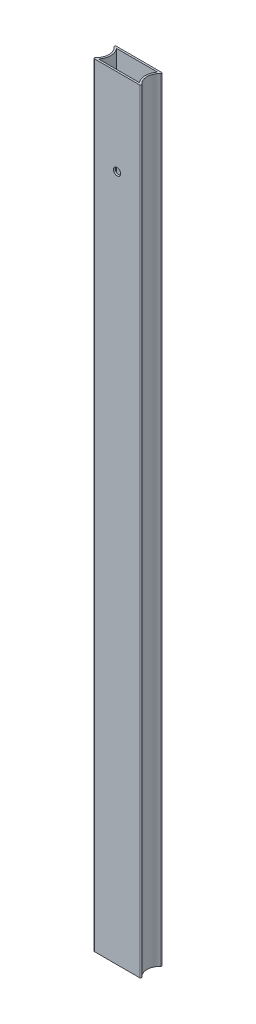
from build123d import *

# Parameters (mm, degrees)
BOSS_EXTRUDE1_DEPTH = 850
SHELL1_T            = -2
SKETCH2_R           = 4
CUT_EXTRUDE1_DEPTH  = 851.730122418


with BuildPart() as part:
    # Sketch1 → Boss-Extrude1 (new body)
    with BuildSketch(Plane(origin=(0, 0, 0), x_dir=(1, 0, 0), z_dir=(0, 1, 0))):
        with BuildLine():
            Line((-24.801960973, -12), (24.801960973, -12))
            ThreePointArc((24.801960973, -12), (25.732910309, -11.365148372), (25.481830241, -10.266666667))
            ThreePointArc((25.481830241, -10.266666667), (21, 0), (25.481830241, 10.266666667))
            ThreePointArc((25.481830241, 10.266666667), (25.732910309, 11.365148372), (24.801960973, 12))
            Line((24.801960973, 12), (-24.801960973, 12))
            ThreePointArc((-24.801960973, 12), (-25.732910309, 11.365148372), (-25.481830241, 10.266666667))
            ThreePointArc((-25.481830241, 10.266666667), (-21, 0), (-25.481830241, -10.266666667))
            ThreePointArc((-25.481830241, -10.266666667), (-25.732910309, -11.365148372), (-24.801960973, -12))
        make_face()
    extrude(amount=BOSS_EXTRUDE1_DEPTH)

    # Shell1
    shell1_openings = [part.faces().sort_by_distance(p)[0] for p in [
        (0, 850, 0),
        (0, 0, 0),
    ]]
    offset(amount=SHELL1_T, openings=shell1_openings, kind=Kind.INTERSECTION)

    # Sketch2 → Cut-Extrude1 (cut, through all)
    with BuildSketch(Plane(origin=(0, 0, -12), x_dir=(-1, 0, 0), z_dir=(0, 0, -1))):
        with Locations((0, 755)):
            Circle(SKETCH2_R)
    extrude(amount=-CUT_EXTRUDE1_DEPTH, mode=Mode.SUBTRACT)


solid = part.part
